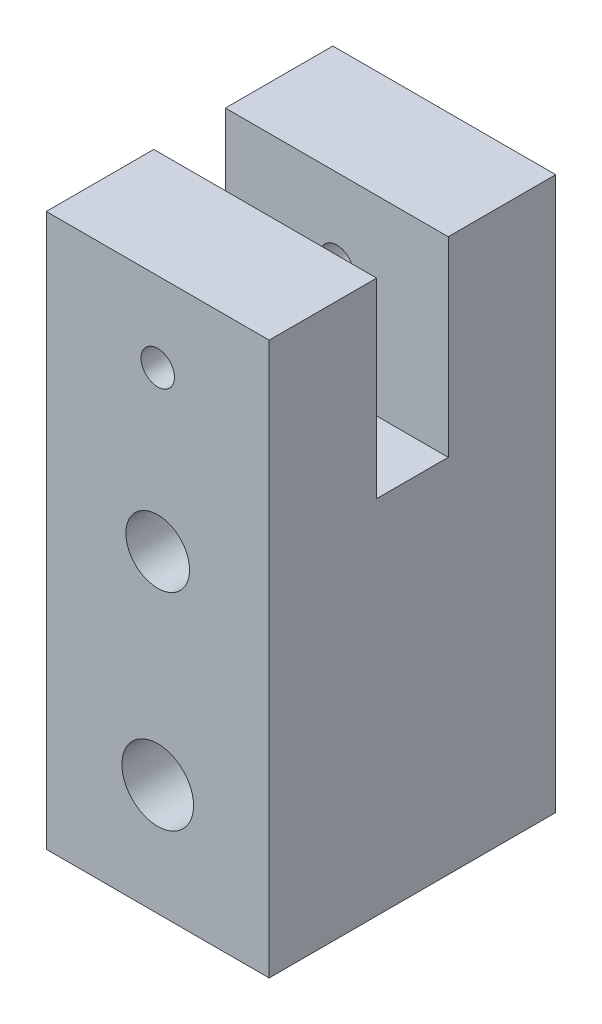
from build123d import *

# Parameters (mm, degrees)
SKETCH2_W           = 14
SKETCH2_H           = 34.7
BOSS_EXTRUDE1_DEPTH = 18
SKETCH3_R           = 2.25
SKETCH3_R_2         = 2
CUT_EXTRUDE1_DEPTH  = 26.961943302
SKETCH4_W           = 4.5
SKETCH4_H           = 12
CUT_EXTRUDE2_DEPTH  = 8
SKETCH5_R           = 1.05
CUT_EXTRUDE3_DEPTH  = 26.961943302
SKETCH8_W           = 4.5
SKETCH8_H           = 7
CUT_EXTRUDE6_DEPTH  = 29.653490189


with BuildPart() as part:
    # Sketch2 → Boss-Extrude1 (new body)
    with BuildSketch(Plane.XY):
        Rectangle(SKETCH2_W, SKETCH2_H)
    extrude(amount=BOSS_EXTRUDE1_DEPTH)

    # Sketch3 → Cut-Extrude1 (cut, through all)
    with BuildSketch(Plane.XY.offset(18)):
        with Locations((0, -10.35)):
            Circle(SKETCH3_R)
        with Locations((0, 2.35)):
            Circle(SKETCH3_R_2)
    extrude(amount=-CUT_EXTRUDE1_DEPTH, mode=Mode.SUBTRACT)

    # Sketch4 → Cut-Extrude2 (cut)
    with BuildSketch(Plane(origin=(7, 0, 0), x_dir=(0, 0, -1), z_dir=(1, 0, 0))):
        with Locations((-9, 11.35)):
            Rectangle(SKETCH4_W, SKETCH4_H)
    extrude(amount=-CUT_EXTRUDE2_DEPTH, mode=Mode.SUBTRACT)

    # Sketch5 → Cut-Extrude3 (cut, through all)
    with BuildSketch(Plane.XY.offset(18)):
        with Locations((0, 12.35)):
            Circle(SKETCH5_R)
    extrude(amount=-CUT_EXTRUDE3_DEPTH, mode=Mode.SUBTRACT)

    # Sketch8 → Cut-Extrude6 (cut, through all)
    with BuildSketch(Plane(origin=(7, 0, 0), x_dir=(0, 0, -1), z_dir=(1, 0, 0))):
        with Locations((-9, 13.85)):
            Rectangle(SKETCH8_W, SKETCH8_H)
    extrude(amount=-CUT_EXTRUDE6_DEPTH, mode=Mode.SUBTRACT)


solid = part.part
